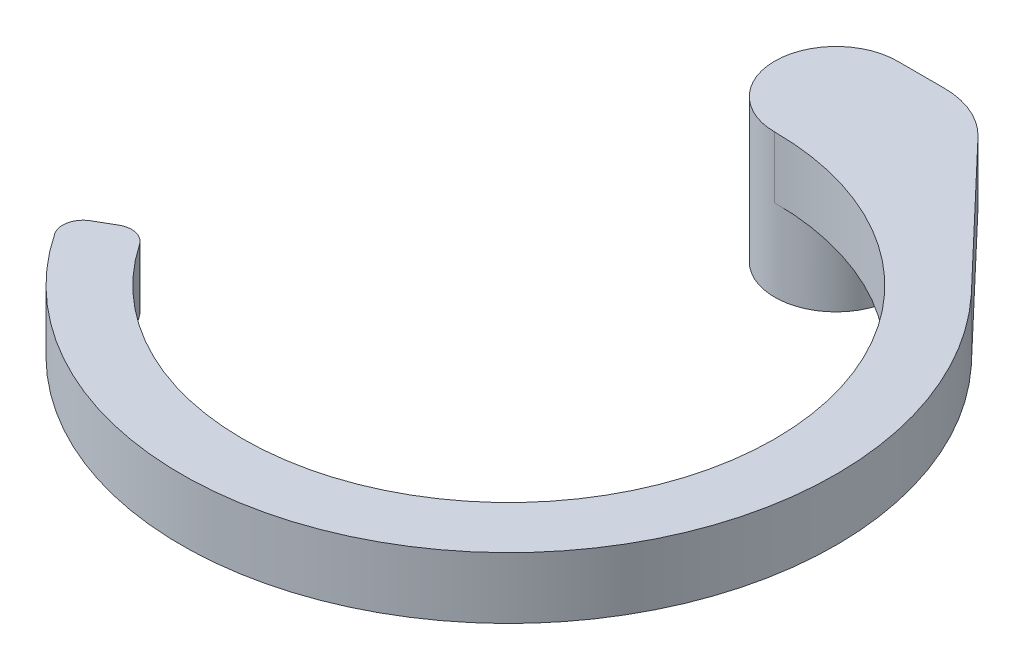
from build123d import *

# Parameters (mm, degrees)
EXTRUDE_4_DEPTH     = 15
EXTRUDE_START       = 20
SKETCH_4_R          = 15
EXTRUDE_5_DEPTH     = 20
SKETCH_5_R          = 10
CUT_EXTRUDE_1_DEPTH = 2


with BuildPart() as part:
    # ｽｹｯﾁ2 → ﾎﾞｽ - 押し出し4 (new body)
    with BuildSketch(Plane(origin=(0, 0, 0), x_dir=(1, 0, 0), z_dir=(0, 1, 0))):
        with BuildLine():
            ThreePointArc((-53.82643789, -36.437818048), (-56.846261527, -34.367935813), (-60.466933112, -34.910600109))
            Line((-60.466933112, -34.910600109), (-64.807406984, -37.416573868))
            ThreePointArc((-64.807406984, -37.416573868), (-67.177509772, -40.614402853), (-66.461234116, -44.529814279))
            ThreePointArc((-66.461234116, -44.529814279), (49.665387485, -62.716419588), (58.57572973, 54.487465409))
            Line((58.57572973, 54.487465409), (57.289371136, 55.838409315))
            Line((57.289371136, 55.838409315), (25.911523347, 88.791671712))
            ThreePointArc((25.911523347, 88.791671712), (19.306695871, 93.382511176), (11.427401304, 95))
            Line((11.427401304, 95), (0, 95))
            ThreePointArc((0, 95), (-15, 80), (0, 65))
            ThreePointArc((0, 65), (57.41714976, -30.467538684), (-53.82643789, -36.437818048))
        make_face()
    extrude(amount=EXTRUDE_4_DEPTH)

    # ｽｹｯﾁ4 → ﾎﾞｽ - 押し出し5 (add)
    with BuildSketch(Plane.XZ.offset(EXTRUDE_START)):
        with Locations(Location((0, -80, 0), (0, 0, 270))):
            Circle(SKETCH_4_R)
    extrude(amount=-EXTRUDE_5_DEPTH)

    # ｽｹｯﾁ5 → ｶｯﾄ - 押し出し1 (cut)
    with BuildSketch(Plane(origin=(0, -20, 0), x_dir=(-1, 0, 0), z_dir=(0, -1, 0))):
        with Locations(Location((0, 80, 0), (0, 0, 90))):
            Circle(SKETCH_5_R)
    extrude(amount=-CUT_EXTRUDE_1_DEPTH, mode=Mode.SUBTRACT)


solid = part.part
